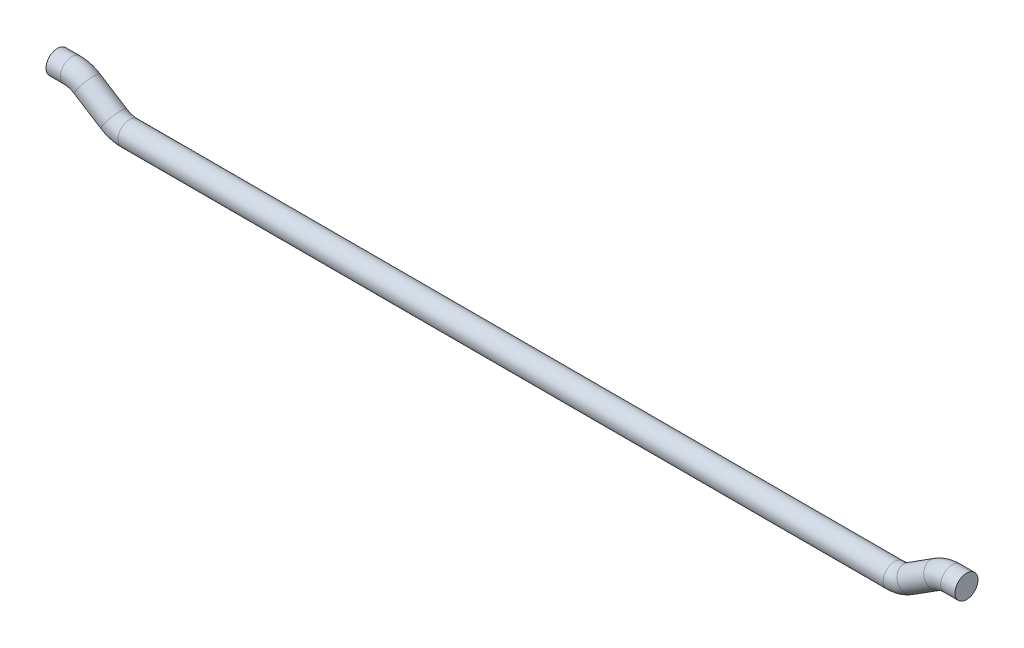
from build123d import *

# Parameters (mm, degrees)
SKETCH1_R = 0.8


with BuildPart() as part:
    # Sweep1: sweep along a path in Sketch2
    with BuildLine(Plane.XY) as sweep1_path:
        Line((0, 0), (1, 0))
        ThreePointArc((1, 0), (1.55762039, -0.079307546), (2.071017274, -0.310940499))
        Line((2.071017274, -0.310940499), (3.928982726, -1.489059501))
        ThreePointArc((3.928982726, -1.489059501), (4.44237961, -1.720692454), (5, -1.8))
        Line((5, -1.8), (58.25, -1.8))
        ThreePointArc((58.25, -1.8), (58.80762039, -1.720692454), (59.321017274, -1.489059501))
        Line((59.321017274, -1.489059501), (61.178982726, -0.310940499))
        ThreePointArc((61.178982726, -0.310940499), (61.69237961, -0.079307546), (62.25, 0))
        Line((62.25, 0), (63.25, 0))
    # Sketch1 → Sweep1 (sweep)
    with BuildSketch(Plane(origin=(0, 0, 0), x_dir=(0, 0, -1), z_dir=(1, 0, 0))):
        Circle(SKETCH1_R)
    sweep(path=sweep1_path.line)


solid = part.part
